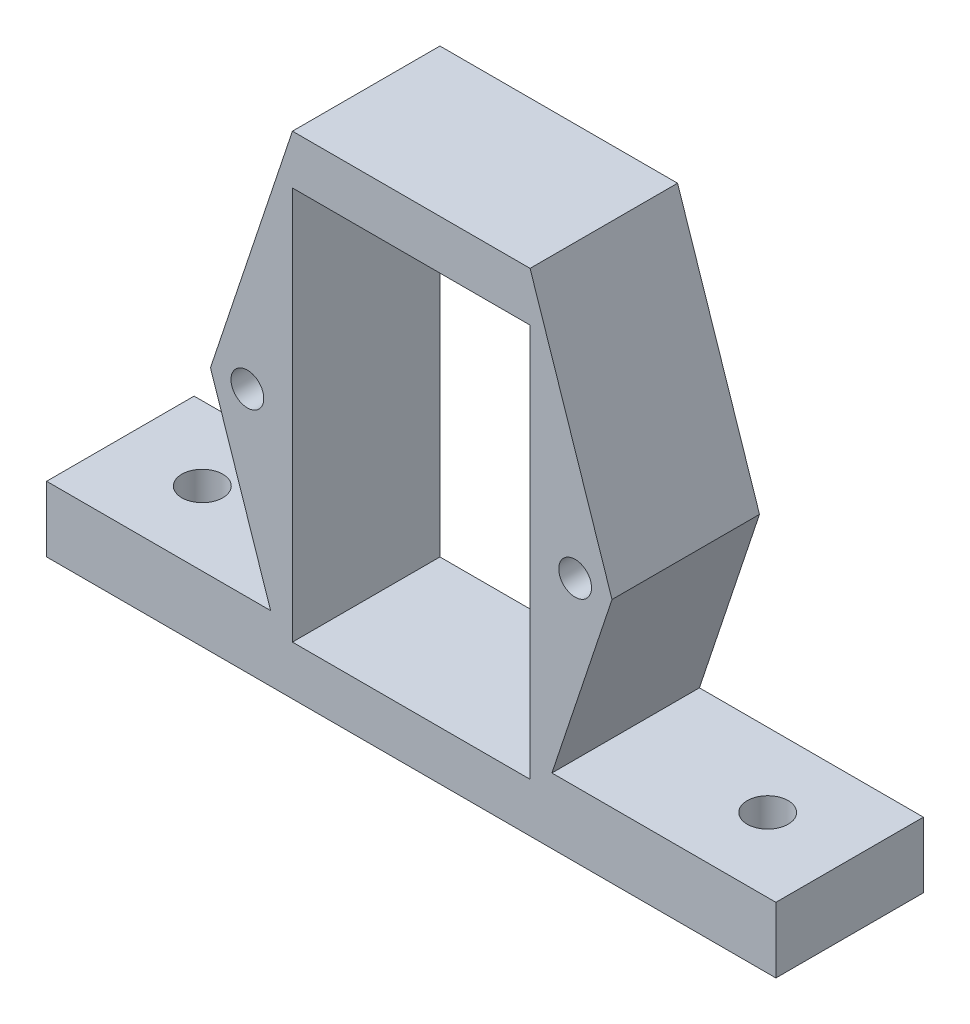
from build123d import *

# Parameters (mm, degrees)
SKETCH_1_R          = 2
EXTRUDE_2_DEPTH     = 18
SKETCH_2_R          = 2.5
CUT_EXTRUDE_1_DEPTH = 18


with BuildPart() as part:
    # 草图1 → 凸台-拉伸2 (new body)
    with BuildSketch(Plane.XY):
        Polygon((2.302405498, 27.458762887), (-26.697594502, 27.458762887), (-36.697594502, -2.541237113), (-29.364261168, -24.541237113), (-56.697594502, -24.541237113), (-56.697594502, -32.541237113), (32.302405498, -32.541237113), (32.302405498, -24.541237113), (4.969072165, -24.541237113), (12.302405498, -2.541237113), align=None)
        with Locations((-32.197594502, -2.541237113)):
            Circle(SKETCH_1_R, mode=Mode.SUBTRACT)
        Polygon((-26.697594502, -26.541237113), (-26.697594502, -2.541237113), (-26.697594502, 21.458762887), (2.302405498, 21.458762887), (2.302405498, -2.541237113), (2.302405498, -26.541237113), align=None, mode=Mode.SUBTRACT)
        with Locations((7.802405498, -2.541237113)):
            Circle(SKETCH_1_R, mode=Mode.SUBTRACT)
    extrude(amount=EXTRUDE_2_DEPTH)

    # 草图2 → 切除-拉伸1 (cut)
    with BuildSketch(Plane(origin=(0, -24.541237113, 0), x_dir=(1, 0, 0), z_dir=(0, 1, 0))):
        with Locations(Location((-46.697594502, -9, 0), (0, 0, 270))):
            Circle(SKETCH_2_R)
        with Locations(Location((22.302405498, -9, 0), (0, 0, 270))):
            Circle(SKETCH_2_R)
    extrude(amount=-CUT_EXTRUDE_1_DEPTH, mode=Mode.SUBTRACT)


solid = part.part
